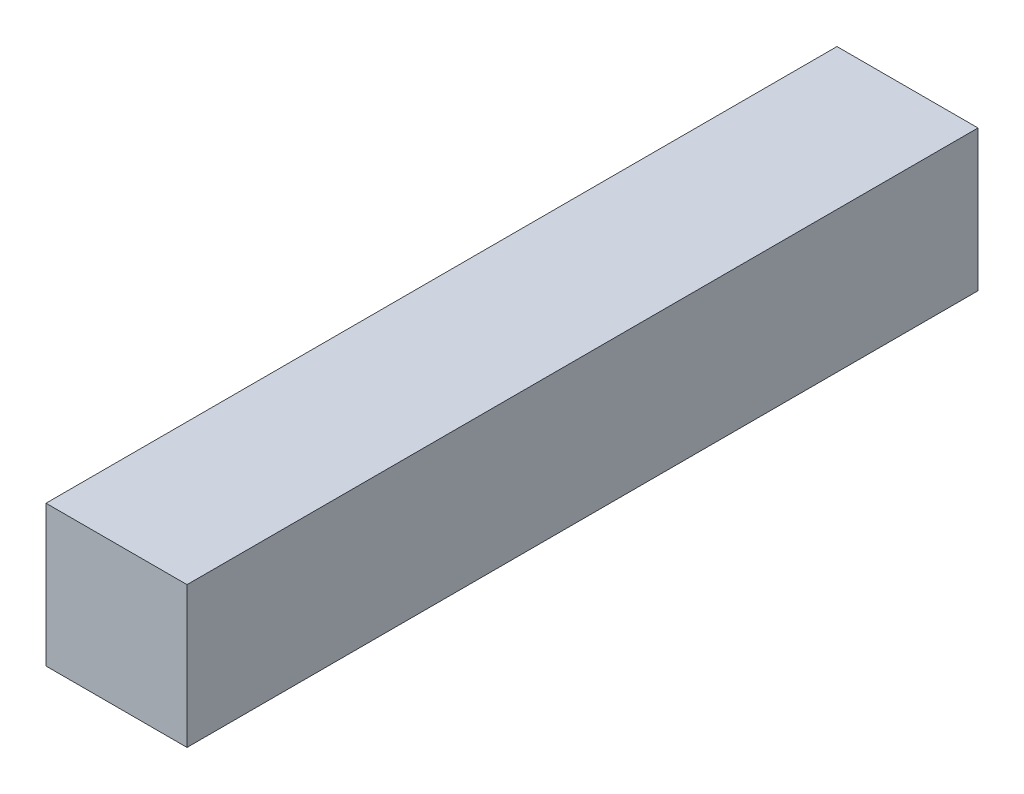
from build123d import *

# Parameters (mm, degrees)
SKETCH1_W           = 7.9248
SKETCH1_H           = 7.9248
BOSS_EXTRUDE1_DEPTH = 22.225


with BuildPart() as part:
    # Sketch1 → Boss-Extrude1 (new, symmetric)
    with BuildSketch(Plane.XY):
        Rectangle(SKETCH1_W, SKETCH1_H)
    extrude(amount=BOSS_EXTRUDE1_DEPTH, both=True)


solid = part.part
